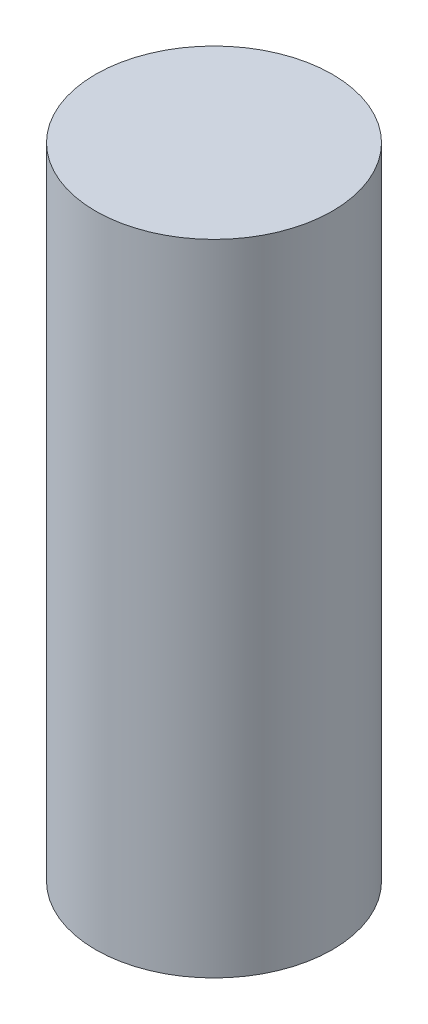
from build123d import *

# Parameters (mm, degrees)
SKETCH1_R           = 5
BOSS_EXTRUDE1_DEPTH = 27


with BuildPart() as part:
    # Sketch1 → Boss-Extrude1 (new body)
    with BuildSketch(Plane(origin=(0, 0, 0), x_dir=(1, 0, 0), z_dir=(0, 1, 0))):
        with Locations(Location((0, 0, 0), (0, 0, 270))):
            Circle(SKETCH1_R)
    extrude(amount=BOSS_EXTRUDE1_DEPTH)


solid = part.part
